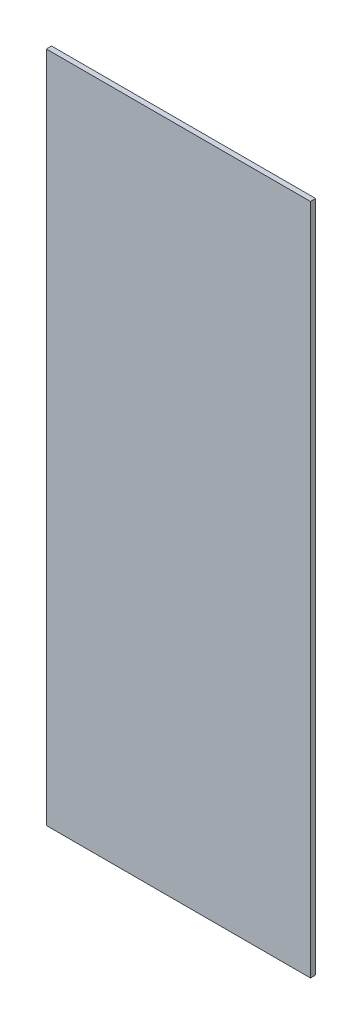
from build123d import *

# Parameters (mm, degrees)
SKETCH1_W           = 648
SKETCH1_H           = 1650
BOSS_EXTRUDE1_DEPTH = 12.7


with BuildPart() as part:
    # Sketch1 → Boss-Extrude1 (new body)
    with BuildSketch(Plane.XY):
        Rectangle(SKETCH1_W, SKETCH1_H)
    extrude(amount=BOSS_EXTRUDE1_DEPTH)


solid = part.part
